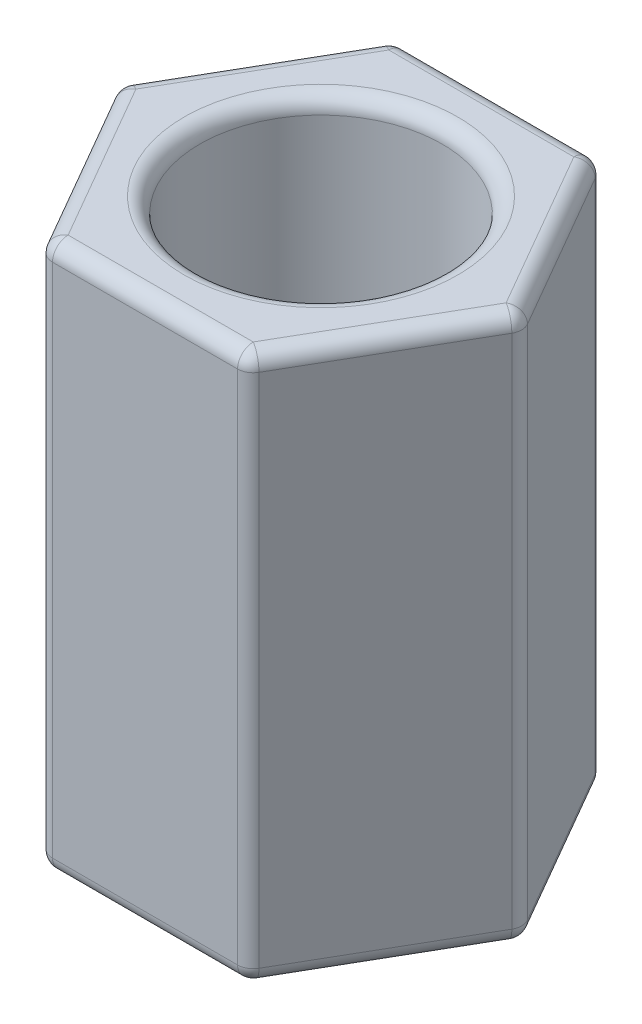
from build123d import *

# Parameters (mm, degrees)
SKETCH1_R           = 1.55
BOSS_EXTRUDE1_DEPTH = 7
FILLET1_R           = 0.2


with BuildPart() as part:
    # Sketch1 → Boss-Extrude1 (new body)
    with BuildSketch(Plane(origin=(0, 0, 0), x_dir=(1, 0, 0), z_dir=(0, 1, 0))):
        Polygon((3.897114317, 4.5), (1.299038106, 4.5), (0, 2.25), (1.299038106, 0), (3.897114317, 0), (5.196152423, 2.25), align=None)
        with Locations(Location((2.598076211, 2.25, 0), (0, 0, 270))):
            Circle(SKETCH1_R, mode=Mode.SUBTRACT)
    extrude(amount=BOSS_EXTRUDE1_DEPTH)

    # Fillet1
    fillet1_edges = [part.edges().sort_by_distance(p)[0] for p in [
        (0.649519053, 0, -1.125),
        (0.649519053, 0, -3.375),
        (2.598076211, 0, -4.5),
        (2.598076211, 0, -3.8),
        (2.598076211, 7, -4.5),
        (3.897114317, 3.5, -4.5),
        (5.196152423, 3.5, -2.25),
        (3.897114317, 3.5, 0),
        (1.299038106, 3.5, 0),
        (0, 3.5, -2.25),
        (1.299038106, 3.5, -4.5),
        (0.649519053, 7, -3.375),
        (0.649519053, 7, -1.125),
        (2.598076211, 7, 0),
        (4.54663337, 7, -1.125),
        (4.54663337, 7, -3.375),
        (2.598076211, 7, -3.8),
        (4.54663337, 0, -3.375),
        (4.54663337, 0, -1.125),
        (2.598076211, 0, 0),
    ]]
    fillet(fillet1_edges, radius=FILLET1_R)


solid = part.part
